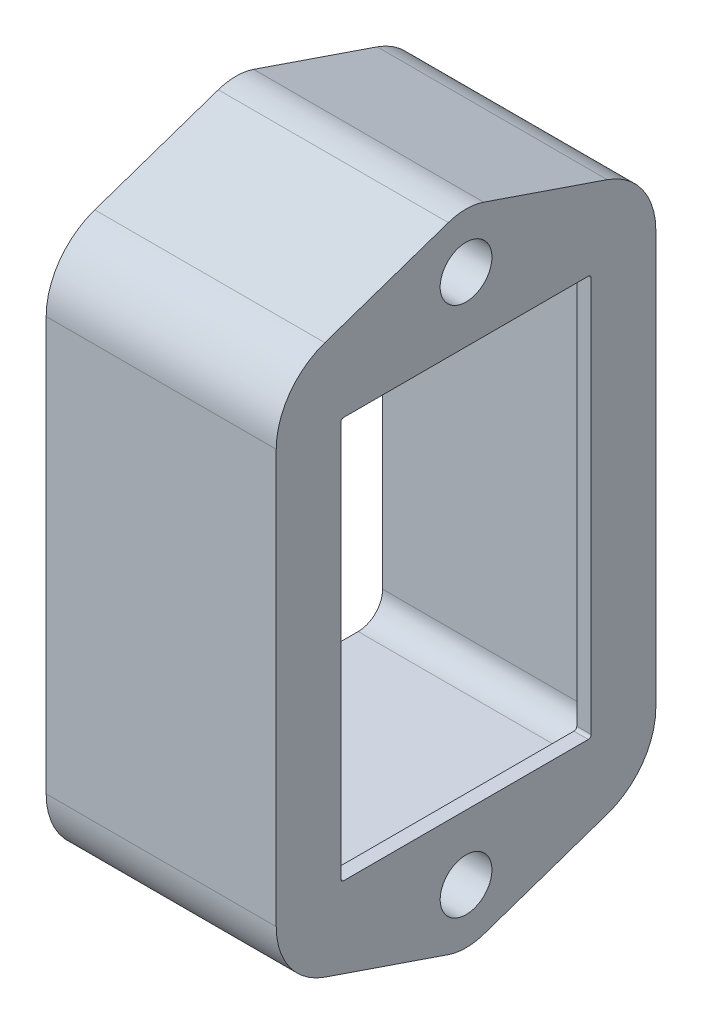
from build123d import *

# Parameters (mm, degrees)
SALIENTE_EXTRUIR1_DEPTH      = 2
SALIENTE_EXTRUIR1_DEPTH_BACK = 30
CROQUIS2_R                   = 3.6
SALIENTE_EXTRUIR2_START      = -2
SALIENTE_EXTRUIR2_DEPTH      = 2


with BuildPart() as part:
    # Croquis2 → Saliente-Extruir1 (new, two sides: drawn at the far end of the back side and taken through both)
    with BuildSketch(Plane(origin=(0, 0, 0), x_dir=(0, 0, -1), z_dir=(1, 0, 0)).offset(-SALIENTE_EXTRUIR1_DEPTH_BACK)):
        with BuildLine():
            Line((-26.4, -41.464925013), (-26.4, 16.039678623))
            ThreePointArc((-26.4, 16.039678623), (-24.535471531, 21.85466813), (-19.637179406, 25.501214941))
            Line((-19.637179406, 25.501214941), (-2.460256349, 31.378144407))
            ThreePointArc((-2.460256349, 31.378144407), (0, 31.787376805), (2.460256349, 31.378144407))
            Line((2.460256349, 31.378144407), (19.637179406, 25.501214941))
            ThreePointArc((19.637179406, 25.501214941), (24.535471531, 21.85466813), (26.4, 16.039678623))
            Line((26.4, 16.039678623), (26.4, -41.464925013))
            ThreePointArc((26.4, -41.464925013), (24.535471531, -47.27991452), (19.637179406, -50.92646133))
            Line((19.637179406, -50.92646133), (2.460256349, -56.803390796))
            ThreePointArc((2.460256349, -56.803390796), (0, -57.212623195), (-2.460256349, -56.803390796))
            Line((-2.460256349, -56.803390796), (-19.637179406, -50.92646133))
            ThreePointArc((-19.637179406, -50.92646133), (-24.535471531, -47.27991452), (-26.4, -41.464925013))
        make_face()
        with Locations((0, 24.187376805)):
            Circle(CROQUIS2_R, mode=Mode.SUBTRACT)
        with Locations(Location((0, -49.612623195, 0), (0, 0, 180))):
            Circle(CROQUIS2_R, mode=Mode.SUBTRACT)
        with BuildLine():
            Line((20.4, -40.212623195), (20.4, 14.787376805))
            ThreePointArc((20.4, 14.787376805), (19.404163056, 17.191539861), (17, 18.187376805))
            Line((17, 18.187376805), (0, 18.187376805))
            Line((0, 18.187376805), (-17, 18.187376805))
            ThreePointArc((-17, 18.187376805), (-19.404163056, 17.191539861), (-20.4, 14.787376805))
            Line((-20.4, 14.787376805), (-20.4, -40.212623195))
            ThreePointArc((-20.4, -40.212623195), (-19.404163056, -42.616786251), (-17, -43.612623195))
            Line((-17, -43.612623195), (0, -43.612623195))
            Line((0, -43.612623195), (17, -43.612623195))
            ThreePointArc((17, -43.612623195), (19.404163056, -42.616786251), (20.4, -40.212623195))
        make_face(mode=Mode.SUBTRACT)
    extrude(amount=SALIENTE_EXTRUIR1_DEPTH + SALIENTE_EXTRUIR1_DEPTH_BACK)

    # Croquis3 → Saliente-Extruir2 (add)
    with BuildSketch(Plane(origin=(2, 0, 0), x_dir=(0, 0, -1), z_dir=(1, 0, 0)).offset(SALIENTE_EXTRUIR2_START)):
        with BuildLine():
            Line((-17, -43.612623195), (17, -43.612623195))
            ThreePointArc((17, -43.612623195), (19.404163056, -42.616786251), (20.4, -40.212623195))
            Line((20.4, -40.212623195), (20.4, 14.787376805))
            ThreePointArc((20.4, 14.787376805), (19.404163056, 17.191539861), (17, 18.187376805))
            Line((17, 18.187376805), (-17, 18.187376805))
            ThreePointArc((-17, 18.187376805), (-19.404163056, 17.191539861), (-20.4, 14.787376805))
            Line((-20.4, 14.787376805), (-20.4, -40.212623195))
            ThreePointArc((-20.4, -40.212623195), (-19.404163056, -42.616786251), (-17, -43.612623195))
        make_face()
        with BuildLine():
            Line((-17, -40.612623195), (17, -40.612623195))
            ThreePointArc((17, -40.612623195), (17.282842712, -40.495465907), (17.4, -40.212623195))
            Line((17.4, -40.212623195), (17.4, 14.787376805))
            ThreePointArc((17.4, 14.787376805), (17.282842712, 15.070219518), (17, 15.187376805))
            Line((17, 15.187376805), (-17, 15.187376805))
            ThreePointArc((-17, 15.187376805), (-17.282842712, 15.070219518), (-17.4, 14.787376805))
            Line((-17.4, 14.787376805), (-17.4, -40.212623195))
            ThreePointArc((-17.4, -40.212623195), (-17.282842712, -40.495465907), (-17, -40.612623195))
        make_face(mode=Mode.SUBTRACT)
    extrude(amount=SALIENTE_EXTRUIR2_DEPTH)


solid = part.part
